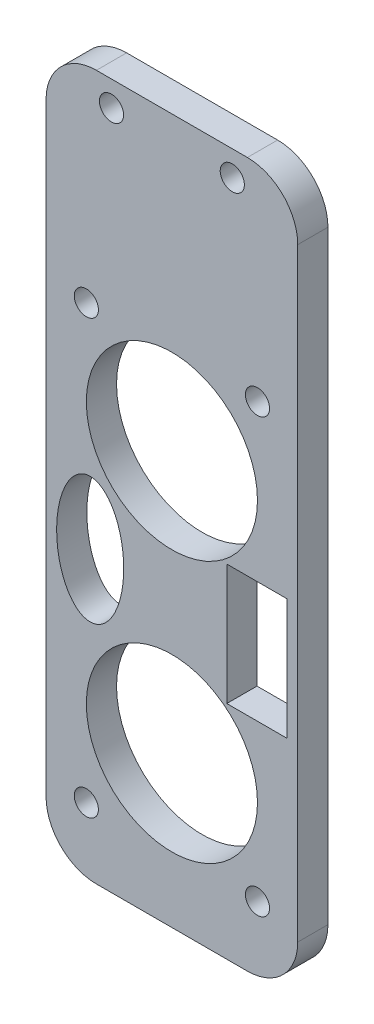
from build123d import *

# Parameters (mm, degrees)
SKETCH1_W            = 25
SKETCH1_H            = 70
SKETCH1_R            = 8.5
SKETCH1_R_2          = 1.2
BOSS_EXTRUDE1_DEPTH  = 3
FILLET1_R            = 5
M2_CLEARANCE_HOLE1_D = 2.4
SKETCH4_W            = 6
SKETCH4_H            = 12
CUT_EXTRUDE1_DEPTH   = 3
SKETCH8_RX           = 6.264875336
SKETCH8_RY           = 3.331610005
CUT_EXTRUDE2_DEPTH   = 3


with BuildPart() as part:
    # Sketch1 → Boss-Extrude1 (new body)
    with BuildSketch(Plane.XY):
        with Locations((12.5, -35)):
            Rectangle(SKETCH1_W, SKETCH1_H)
        with Locations((12.5, -29)):
            Circle(SKETCH1_R, mode=Mode.SUBTRACT)
        with Locations((12.5, -55)):
            Circle(SKETCH1_R, mode=Mode.SUBTRACT)
        with Locations((21, -63.5)):
            Circle(SKETCH1_R_2, mode=Mode.SUBTRACT)
        with Locations((4, -63.5)):
            Circle(SKETCH1_R_2, mode=Mode.SUBTRACT)
        with Locations((4, -20.5)):
            Circle(SKETCH1_R_2, mode=Mode.SUBTRACT)
        with Locations((21, -20.5)):
            Circle(SKETCH1_R_2, mode=Mode.SUBTRACT)
    extrude(amount=BOSS_EXTRUDE1_DEPTH)

    # Fillet1
    fillet1_edges = [part.edges().sort_by_distance(p)[0] for p in [
        (0, 0, 1.5),
        (25, 0, 1.5),
        (25, -70, 1.5),
        (0, -70, 1.5),
    ]]
    fillet(fillet1_edges, radius=FILLET1_R)

    # M2 Clearance Hole1 (through all)
    with Locations(Plane.XY.offset(3)):
        with Locations((6.5, -2.5), (18.5, -2.5)):
            Hole(M2_CLEARANCE_HOLE1_D / 2)

    # Sketch4 → Cut-Extrude1 (cut)
    with BuildSketch(Plane.XY.offset(3)):
        with Locations((20.953787987, -42)):
            Rectangle(SKETCH4_W, SKETCH4_H)
    extrude(amount=-CUT_EXTRUDE1_DEPTH, mode=Mode.SUBTRACT)

    # Sketch8 → Cut-Extrude2 (cut)
    with BuildSketch(Plane(origin=(0, 0, 0), x_dir=(-1, 0, 0), z_dir=(0, 0, -1))):
        with Locations(Location((-4.382036581, -41.5), (0, 0, -90))):
            Ellipse(SKETCH8_RX, SKETCH8_RY)
    extrude(amount=-CUT_EXTRUDE2_DEPTH, mode=Mode.SUBTRACT)


solid = part.part
